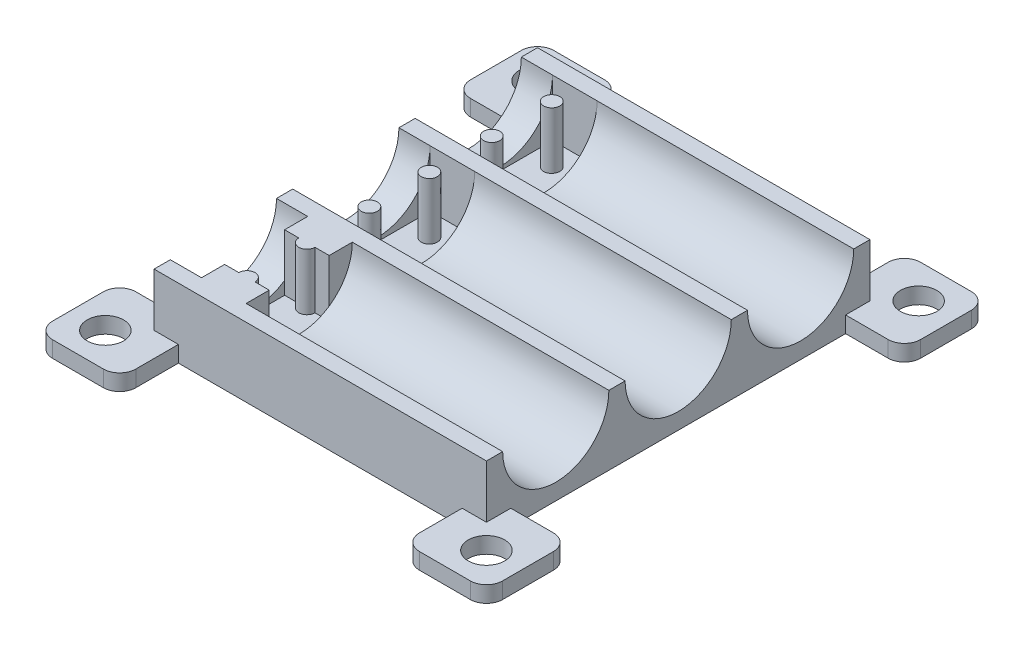
from build123d import *

# Parameters (mm, degrees)
BOSS_EXTRUDE1_DEPTH = 41
BOSS_EXTRUDE2_REACH = 50.098
SKETCH2_R           = 1
SKETCH4_W           = 5.5
SKETCH4_H           = 13.1
SKETCH4_R           = 1
CUT_EXTRUDE1_DEPTH  = 7
SKETCH5_R           = 2.25
BOSS_EXTRUDE3_DEPTH = 2
BOSS_EXTRUDE4_REACH = 59.938
SKETCH6_W           = 5.5
SKETCH6_H           = 2.85
CUT_EXTRUDE2_DEPTH  = 7


with BuildPart() as part:
    # Sketch1 → Boss-Extrude1 (new body)
    with BuildSketch(Plane(origin=(0, 0, 0), x_dir=(0, 0, -1), z_dir=(1, 0, 0))):
        with BuildLine():
            Line((-8.55, 0), (-6.55, 0))
            ThreePointArc((-6.55, 0), (0, -6.55), (6.55, 0))
            Line((6.55, 0), (8.55, 0))
            ThreePointArc((8.55, 0), (15.1, -6.55), (21.65, 0))
            Line((21.65, 0), (23.65, 0))
            Line((23.65, 0), (23.65, -8.55))
            Line((23.65, -8.55), (-23.65, -8.55))
            Line((-23.65, -8.55), (-23.65, 0))
            Line((-23.65, 0), (-21.65, 0))
            ThreePointArc((-21.65, 0), (-15.1, -6.55), (-8.55, 0))
        make_face()
    extrude(amount=BOSS_EXTRUDE1_DEPTH)

    # Sketch2 → Boss-Extrude2 (add, up to next)
    with BuildSketch(Plane(origin=(0, 0, 0), x_dir=(1, 0, 0), z_dir=(0, 1, 0)), mode=Mode.PRIVATE) as boss_extrude2_sk1:
        with Locations(Location((6.6, 3.7, 0), (0, 0, 270))):
            Circle(SKETCH2_R)
    boss_extrude2_tool1 = extrude(boss_extrude2_sk1.sketch, amount=-BOSS_EXTRUDE2_REACH, mode=Mode.PRIVATE) - part.part
    # Sketch2 → Boss-Extrude2 (add, up to next)
    with BuildSketch(Plane(origin=(0, 0, 0), x_dir=(1, 0, 0), z_dir=(0, 1, 0)), mode=Mode.PRIVATE) as boss_extrude2_sk2:
        with Locations(Location((6.6, -3.7, 0), (0, 0, 270))):
            Circle(SKETCH2_R)
    boss_extrude2_tool2 = extrude(boss_extrude2_sk2.sketch, amount=-BOSS_EXTRUDE2_REACH, mode=Mode.PRIVATE) - part.part
    # Sketch2 → Boss-Extrude2 (add, up to next)
    with BuildSketch(Plane(origin=(0, 0, 0), x_dir=(1, 0, 0), z_dir=(0, 1, 0)), mode=Mode.PRIVATE) as boss_extrude2_sk3:
        with Locations(Location((6.6, -11.4, 0), (0, 0, 270))):
            Circle(SKETCH2_R)
    boss_extrude2_tool3 = extrude(boss_extrude2_sk3.sketch, amount=-BOSS_EXTRUDE2_REACH, mode=Mode.PRIVATE) - part.part
    # Sketch2 → Boss-Extrude2 (add, up to next)
    with BuildSketch(Plane(origin=(0, 0, 0), x_dir=(1, 0, 0), z_dir=(0, 1, 0)), mode=Mode.PRIVATE) as boss_extrude2_sk4:
        with Locations(Location((6.6, -18.8, 0), (0, 0, 270))):
            Circle(SKETCH2_R)
    boss_extrude2_tool4 = extrude(boss_extrude2_sk4.sketch, amount=-BOSS_EXTRUDE2_REACH, mode=Mode.PRIVATE) - part.part
    # Sketch2 → Boss-Extrude2 (add, up to next)
    with BuildSketch(Plane(origin=(0, 0, 0), x_dir=(1, 0, 0), z_dir=(0, 1, 0)), mode=Mode.PRIVATE) as boss_extrude2_sk5:
        with Locations(Location((6.6, 18.8, 0), (0, 0, 270))):
            Circle(SKETCH2_R)
    boss_extrude2_tool5 = extrude(boss_extrude2_sk5.sketch, amount=-BOSS_EXTRUDE2_REACH, mode=Mode.PRIVATE) - part.part
    # Sketch2 → Boss-Extrude2 (add, up to next)
    with BuildSketch(Plane(origin=(0, 0, 0), x_dir=(1, 0, 0), z_dir=(0, 1, 0)), mode=Mode.PRIVATE) as boss_extrude2_sk6:
        with Locations(Location((6.6, 11.4, 0), (0, 0, 270))):
            Circle(SKETCH2_R)
    boss_extrude2_tool6 = extrude(boss_extrude2_sk6.sketch, amount=-BOSS_EXTRUDE2_REACH, mode=Mode.PRIVATE) - part.part
    add(boss_extrude2_tool1.solids().sort_by_distance((6.6, 0, -3.7))[0])
    add(boss_extrude2_tool2.solids().sort_by_distance((6.6, 0, 3.7))[0])
    add(boss_extrude2_tool3.solids().sort_by_distance((6.6, 0, 11.4))[0])
    add(boss_extrude2_tool4.solids().sort_by_distance((6.6, 0, 18.8))[0])
    add(boss_extrude2_tool5.solids().sort_by_distance((6.6, 0, -18.8))[0])
    add(boss_extrude2_tool6.solids().sort_by_distance((6.6, 0, -11.4))[0])

    # Sketch4 → Cut-Extrude1 (cut)
    # profile 1 of 3: a face of its own
    with BuildSketch(Plane(origin=(0, 0, 0), x_dir=(1, 0, 0), z_dir=(0, 1, 0))):
        with Locations((6.6, 0)):
            Rectangle(SKETCH4_W, SKETCH4_H)
        with Locations(Location((6.6, 3.7, 0), (0, 0, 270))):
            Circle(SKETCH4_R, mode=Mode.SUBTRACT)
        with Locations(Location((6.6, -3.7, 0), (0, 0, 270))):
            Circle(SKETCH4_R, mode=Mode.SUBTRACT)
    # profile 2 of 3: a face of its own
    with BuildSketch(Plane(origin=(0, 0, 0), x_dir=(1, 0, 0), z_dir=(0, 1, 0))):
        with Locations((6.6, -15.1)):
            Rectangle(SKETCH4_W, SKETCH4_H)
        with Locations(Location((6.6, -11.4, 0), (0, 0, 90))):
            Circle(SKETCH4_R, mode=Mode.SUBTRACT)
        with Locations(Location((6.6, -18.8, 0), (0, 0, 90))):
            Circle(SKETCH4_R, mode=Mode.SUBTRACT)
    # profile 3 of 3: a face of its own
    with BuildSketch(Plane(origin=(0, 0, 0), x_dir=(1, 0, 0), z_dir=(0, 1, 0))):
        with Locations((6.6, 15.1)):
            Rectangle(SKETCH4_W, SKETCH4_H)
        with Locations(Location((6.6, 11.4, 0), (0, 0, 90))):
            Circle(SKETCH4_R, mode=Mode.SUBTRACT)
        with Locations(Location((6.6, 18.8, 0), (0, 0, 90))):
            Circle(SKETCH4_R, mode=Mode.SUBTRACT)
    extrude(amount=-CUT_EXTRUDE1_DEPTH, mode=Mode.SUBTRACT)

    # Sketch5 → Boss-Extrude3 (add)
    # profile 1 of 4: a face of its own
    with BuildSketch(Plane.XZ.offset(8.55)):
        with BuildLine():
            Line((0, 23.65), (0, 20.65))
            Line((0, 20.65), (-5.25520382, 20.65))
            ThreePointArc((-5.25520382, 20.65), (-6.669417382, 21.235786438), (-7.25520382, 22.65))
            Line((-7.25520382, 22.65), (-7.25520382, 28.90520382))
            ThreePointArc((-7.25520382, 28.90520382), (-6.669417382, 30.319417382), (-5.25520382, 30.90520382))
            Line((-5.25520382, 30.90520382), (1, 30.90520382))
            ThreePointArc((1, 30.90520382), (2.414213562, 30.319417382), (3, 28.90520382))
            Line((3, 28.90520382), (3, 23.65))
            Line((3, 23.65), (0, 23.65))
        make_face()
        with Locations(Location((-3.00520382, 26.65520382, 0), (0, 0, 270))):
            Circle(SKETCH5_R, mode=Mode.SUBTRACT)
    # profile 2 of 4: a face of its own
    with BuildSketch(Plane.XZ.offset(8.55)):
        with BuildLine():
            Line((0, -23.65), (3, -23.65))
            Line((3, -23.65), (3, -28.90520382))
            ThreePointArc((3, -28.90520382), (2.414213562, -30.319417382), (1, -30.90520382))
            Line((1, -30.90520382), (-5.25520382, -30.90520382))
            ThreePointArc((-5.25520382, -30.90520382), (-6.669417382, -30.319417382), (-7.25520382, -28.90520382))
            Line((-7.25520382, -28.90520382), (-7.25520382, -22.65))
            ThreePointArc((-7.25520382, -22.65), (-6.669417382, -21.235786438), (-5.25520382, -20.65))
            Line((-5.25520382, -20.65), (0, -20.65))
            Line((0, -20.65), (0, -23.65))
        make_face()
        with Locations(Location((-3.00520382, -26.65520382, 0), (0, 0, 90))):
            Circle(SKETCH5_R, mode=Mode.SUBTRACT)
    # profile 3 of 4: a face of its own
    with BuildSketch(Plane.XZ.offset(8.55)):
        with BuildLine():
            Line((41, -23.65), (41, -20.65))
            Line((41, -20.65), (46.25520382, -20.65))
            ThreePointArc((46.25520382, -20.65), (47.669417382, -21.235786438), (48.25520382, -22.65))
            Line((48.25520382, -22.65), (48.25520382, -28.90520382))
            ThreePointArc((48.25520382, -28.90520382), (47.669417382, -30.319417382), (46.25520382, -30.90520382))
            Line((46.25520382, -30.90520382), (40, -30.90520382))
            ThreePointArc((40, -30.90520382), (38.585786438, -30.319417382), (38, -28.90520382))
            Line((38, -28.90520382), (38, -23.65))
            Line((38, -23.65), (41, -23.65))
        make_face()
        with Locations(Location((44.00520382, -26.65520382, 0), (0, 0, 270))):
            Circle(SKETCH5_R, mode=Mode.SUBTRACT)
    # profile 4 of 4: a face of its own
    with BuildSketch(Plane.XZ.offset(8.55)):
        with BuildLine():
            Line((41, 23.65), (38, 23.65))
            Line((38, 23.65), (38, 28.90520382))
            ThreePointArc((38, 28.90520382), (38.585786438, 30.319417382), (40, 30.90520382))
            Line((40, 30.90520382), (46.25520382, 30.90520382))
            ThreePointArc((46.25520382, 30.90520382), (47.669417382, 30.319417382), (48.25520382, 28.90520382))
            Line((48.25520382, 28.90520382), (48.25520382, 22.65))
            ThreePointArc((48.25520382, 22.65), (47.669417382, 21.235786438), (46.25520382, 20.65))
            Line((46.25520382, 20.65), (41, 20.65))
            Line((41, 20.65), (41, 23.65))
        make_face()
        with Locations(Location((44.00520382, 26.65520382, 0), (0, 0, 90))):
            Circle(SKETCH5_R, mode=Mode.SUBTRACT)
    extrude(amount=-BOSS_EXTRUDE3_DEPTH)

    # Boss-Extrude4: up to this face of the body (flat: up to its plane)
    boss_extrude4_end = Plane(part.part.faces().sort_by_distance((6.6, -7, -15.1))[0])
    # Sketch6 → Boss-Extrude4 (add, up to the picked face)
    with BuildSketch(Plane(origin=(0, 0, 0), x_dir=(1, 0, 0), z_dir=(0, 1, 0)), mode=Mode.PRIVATE) as boss_extrude4_sk1:
        with Locations((6.6, -5.125)):
            Rectangle(SKETCH6_W, SKETCH6_H)
    boss_extrude4_tool1 = split(extrude(boss_extrude4_sk1.sketch, amount=-BOSS_EXTRUDE4_REACH, mode=Mode.PRIVATE), bisect_by=boss_extrude4_end, keep=Keep.BOTH, mode=Mode.PRIVATE)
    # Sketch6 → Boss-Extrude4 (add, up to the picked face)
    with BuildSketch(Plane(origin=(0, 0, 0), x_dir=(1, 0, 0), z_dir=(0, 1, 0)), mode=Mode.PRIVATE) as boss_extrude4_sk2:
        with Locations((6.6, 5.125)):
            Rectangle(SKETCH6_W, SKETCH6_H)
    boss_extrude4_tool2 = split(extrude(boss_extrude4_sk2.sketch, amount=-BOSS_EXTRUDE4_REACH, mode=Mode.PRIVATE), bisect_by=boss_extrude4_end, keep=Keep.BOTH, mode=Mode.PRIVATE)
    # Sketch6 → Boss-Extrude4 (add, up to the picked face)
    with BuildSketch(Plane(origin=(0, 0, 0), x_dir=(1, 0, 0), z_dir=(0, 1, 0)), mode=Mode.PRIVATE) as boss_extrude4_sk3:
        with Locations((6.6, -20.225)):
            Rectangle(SKETCH6_W, SKETCH6_H)
    boss_extrude4_tool3 = split(extrude(boss_extrude4_sk3.sketch, amount=-BOSS_EXTRUDE4_REACH, mode=Mode.PRIVATE), bisect_by=boss_extrude4_end, keep=Keep.BOTH, mode=Mode.PRIVATE)
    # Sketch6 → Boss-Extrude4 (add, up to the picked face)
    with BuildSketch(Plane(origin=(0, 0, 0), x_dir=(1, 0, 0), z_dir=(0, 1, 0)), mode=Mode.PRIVATE) as boss_extrude4_sk4:
        with Locations((6.6, -9.975)):
            Rectangle(SKETCH6_W, SKETCH6_H)
    boss_extrude4_tool4 = split(extrude(boss_extrude4_sk4.sketch, amount=-BOSS_EXTRUDE4_REACH, mode=Mode.PRIVATE), bisect_by=boss_extrude4_end, keep=Keep.BOTH, mode=Mode.PRIVATE)
    # Sketch6 → Boss-Extrude4 (add, up to the picked face)
    with BuildSketch(Plane(origin=(0, 0, 0), x_dir=(1, 0, 0), z_dir=(0, 1, 0)), mode=Mode.PRIVATE) as boss_extrude4_sk5:
        with Locations((6.6, 9.975)):
            Rectangle(SKETCH6_W, SKETCH6_H)
    boss_extrude4_tool5 = split(extrude(boss_extrude4_sk5.sketch, amount=-BOSS_EXTRUDE4_REACH, mode=Mode.PRIVATE), bisect_by=boss_extrude4_end, keep=Keep.BOTH, mode=Mode.PRIVATE)
    # Sketch6 → Boss-Extrude4 (add, up to the picked face)
    with BuildSketch(Plane(origin=(0, 0, 0), x_dir=(1, 0, 0), z_dir=(0, 1, 0)), mode=Mode.PRIVATE) as boss_extrude4_sk6:
        with Locations((6.6, 20.225)):
            Rectangle(SKETCH6_W, SKETCH6_H)
    boss_extrude4_tool6 = split(extrude(boss_extrude4_sk6.sketch, amount=-BOSS_EXTRUDE4_REACH, mode=Mode.PRIVATE), bisect_by=boss_extrude4_end, keep=Keep.BOTH, mode=Mode.PRIVATE)
    add(boss_extrude4_tool1.solids().sort_by(Axis((6.6, 0, 5.125), (0, -1, 0)))[0])
    add(boss_extrude4_tool2.solids().sort_by(Axis((6.6, 0, -5.125), (0, -1, 0)))[0])
    add(boss_extrude4_tool3.solids().sort_by(Axis((6.6, 0, 20.225), (0, -1, 0)))[0])
    add(boss_extrude4_tool4.solids().sort_by(Axis((6.6, 0, 9.975), (0, -1, 0)))[0])
    add(boss_extrude4_tool5.solids().sort_by(Axis((6.6, 0, -9.975), (0, -1, 0)))[0])
    add(boss_extrude4_tool6.solids().sort_by(Axis((6.6, 0, -20.225), (0, -1, 0)))[0])

    # Sketch7 → Cut-Extrude2 (cut)
    with BuildSketch(Plane(origin=(0, 0, 0), x_dir=(1, 0, 0), z_dir=(0, 1, 0))):
        with BuildLine():
            Line((5.6, 3.7), (3.85, 3.7))
            Line((3.85, 3.7), (3.85, 6.55))
            Line((3.85, 6.55), (9.35, 6.55))
            Line((9.35, 6.55), (9.35, 3.7))
            Line((9.35, 3.7), (7.6, 3.7))
            ThreePointArc((7.6, 3.7), (6.6, 4.7), (5.6, 3.7))
        make_face()
        with BuildLine():
            Line((7.6, -3.7), (9.35, -3.7))
            Line((9.35, -3.7), (9.35, -6.55))
            Line((9.35, -6.55), (3.85, -6.55))
            Line((3.85, -6.55), (3.85, -3.7))
            Line((3.85, -3.7), (5.6, -3.7))
            ThreePointArc((5.6, -3.7), (6.6, -4.7), (7.6, -3.7))
        make_face()
        with BuildLine():
            Line((5.6, 18.8), (3.85, 18.8))
            Line((3.85, 18.8), (3.85, 21.65))
            Line((3.85, 21.65), (9.35, 21.65))
            Line((9.35, 21.65), (9.35, 18.8))
            Line((9.35, 18.8), (7.6, 18.8))
            ThreePointArc((7.6, 18.8), (6.6, 19.8), (5.6, 18.8))
        make_face()
        with BuildLine():
            Line((7.6, 11.4), (9.35, 11.4))
            Line((9.35, 11.4), (9.35, 8.55))
            Line((9.35, 8.55), (3.85, 8.55))
            Line((3.85, 8.55), (3.85, 11.4))
            Line((3.85, 11.4), (5.6, 11.4))
            ThreePointArc((5.6, 11.4), (6.6, 10.4), (7.6, 11.4))
        make_face()
    extrude(amount=-CUT_EXTRUDE2_DEPTH, mode=Mode.SUBTRACT)


solid = part.part
